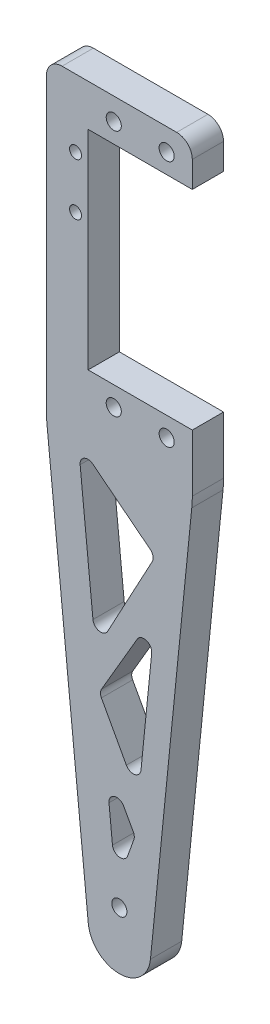
from build123d import *

# Parameters (mm, degrees)
BOSS_EXTRU_1_DEPTH      = 6
CONG_1_R                = 3
CONG_2_R                = 20
ENL_V_MAT_EXTRU_1_REACH = 118.402
ESQUISSE2_R             = 1.45
ENL_V_MAT_EXTRU_2_REACH = 118.402
CONG_3_R                = 1.5
ESQUISSE4_R             = 1.45
ENL_V_MAT_EXTRU_3_DEPTH = 6
ESQUISSE5_R             = 1.15
ENL_V_MAT_EXTRU_4_DEPTH = 6


with BuildPart() as part:
    # Esquisse1 → Boss.-Extru.1 (new body)
    with BuildSketch(Plane.XY):
        with BuildLine():
            Line((-14, -30), (-5.970001079, -110))
            ThreePointArc((-5.970001079, -110), (0, -115.400761222), (5.970001079, -110))
            Line((5.970001079, -110), (14, -30))
            Line((14, -30), (14, -18))
            Line((14, -18), (-6, -18))
            Line((-6, -18), (-6, 22))
            Line((-6, 22), (14, 22))
            Line((14, 22), (14, 30))
            Line((14, 30), (-14, 30))
            Line((-14, 30), (-14, -30))
        make_face()
    extrude(amount=BOSS_EXTRU_1_DEPTH)

    # Congé1
    cong_1_edges = [part.edges().sort_by_distance(p)[0] for p in [
        (-14, 30, 3),
        (14, 30, 3),
    ]]
    fillet(cong_1_edges, radius=CONG_1_R)

    # Congé2
    cong_2_edges = [part.edges().sort_by_distance(p)[0] for p in [
        (14, -30, 3),
        (-14, -30, 3),
    ]]
    fillet(cong_2_edges, radius=CONG_2_R)

    # Esquisse2 → Enlèv. mat.-Extru.1 (cut, up to next)
    with BuildSketch(Plane.XY.offset(6), mode=Mode.PRIVATE) as enl_v_mat_extru_1_sk1:
        with Locations((9.08, -21.75)):
            Circle(ESQUISSE2_R)
    enl_v_mat_extru_1_tool1 = extrude(enl_v_mat_extru_1_sk1.sketch, amount=-ENL_V_MAT_EXTRU_1_REACH, mode=Mode.PRIVATE) & part.part
    # Esquisse2 → Enlèv. mat.-Extru.1 (cut, up to next)
    with BuildSketch(Plane.XY.offset(6), mode=Mode.PRIVATE) as enl_v_mat_extru_1_sk2:
        with Locations((-1.08, -21.75)):
            Circle(ESQUISSE2_R)
    enl_v_mat_extru_1_tool2 = extrude(enl_v_mat_extru_1_sk2.sketch, amount=-ENL_V_MAT_EXTRU_1_REACH, mode=Mode.PRIVATE) & part.part
    # Esquisse2 → Enlèv. mat.-Extru.1 (cut, up to next)
    with BuildSketch(Plane.XY.offset(6), mode=Mode.PRIVATE) as enl_v_mat_extru_1_sk3:
        with Locations((-1.08, 25.75)):
            Circle(ESQUISSE2_R)
    enl_v_mat_extru_1_tool3 = extrude(enl_v_mat_extru_1_sk3.sketch, amount=-ENL_V_MAT_EXTRU_1_REACH, mode=Mode.PRIVATE) & part.part
    # Esquisse2 → Enlèv. mat.-Extru.1 (cut, up to next)
    with BuildSketch(Plane.XY.offset(6), mode=Mode.PRIVATE) as enl_v_mat_extru_1_sk4:
        with Locations((9.08, 25.75)):
            Circle(ESQUISSE2_R)
    enl_v_mat_extru_1_tool4 = extrude(enl_v_mat_extru_1_sk4.sketch, amount=-ENL_V_MAT_EXTRU_1_REACH, mode=Mode.PRIVATE) & part.part
    add(enl_v_mat_extru_1_tool1.solids().sort_by_distance((9.08, -21.75, 6))[0], mode=Mode.SUBTRACT)
    add(enl_v_mat_extru_1_tool2.solids().sort_by_distance((-1.08, -21.75, 6))[0], mode=Mode.SUBTRACT)
    add(enl_v_mat_extru_1_tool3.solids().sort_by_distance((-1.08, 25.75, 6))[0], mode=Mode.SUBTRACT)
    add(enl_v_mat_extru_1_tool4.solids().sort_by_distance((9.08, 25.75, 6))[0], mode=Mode.SUBTRACT)

    # Esquisse3 → Enlèv. mat.-Extru.2 (cut, up to next)
    with BuildSketch(Plane.XY.offset(6), mode=Mode.PRIVATE) as enl_v_mat_extru_2_sk1:
        Polygon((-7.886583597, -31.017533633), (-4.584381628, -63.916187805), (6.894740823, -42.63737417), align=None)
    enl_v_mat_extru_2_tool1 = extrude(enl_v_mat_extru_2_sk1.sketch, amount=-ENL_V_MAT_EXTRU_2_REACH, mode=Mode.PRIVATE) & part.part
    # Esquisse3 → Enlèv. mat.-Extru.2 (cut, up to next)
    with BuildSketch(Plane.XY.offset(6), mode=Mode.PRIVATE) as enl_v_mat_extru_2_sk2:
        Polygon((6.894740823, -52.121802831), (-3.854189345, -70.511493223), (3.66385974, -84.30991259), align=None)
    enl_v_mat_extru_2_tool2 = extrude(enl_v_mat_extru_2_sk2.sketch, amount=-ENL_V_MAT_EXTRU_2_REACH, mode=Mode.PRIVATE) & part.part
    # Esquisse3 → Enlèv. mat.-Extru.2 (cut, up to next)
    with BuildSketch(Plane.XY.offset(6), mode=Mode.PRIVATE) as enl_v_mat_extru_2_sk3:
        Polygon((-2.728137467, -80.682315655), (-0.663223344, -101.254314661), (3.006387716, -91.078168987), align=None)
    enl_v_mat_extru_2_tool3 = extrude(enl_v_mat_extru_2_sk3.sketch, amount=-ENL_V_MAT_EXTRU_2_REACH, mode=Mode.PRIVATE) & part.part
    add(enl_v_mat_extru_2_tool1.solids().sort_by_distance((-1.858741, -45.857032, 6))[0], mode=Mode.SUBTRACT)
    add(enl_v_mat_extru_2_tool2.solids().sort_by_distance((2.234804, -68.98107, 6))[0], mode=Mode.SUBTRACT)
    add(enl_v_mat_extru_2_tool3.solids().sort_by_distance((-0.128324, -91.004933, 6))[0], mode=Mode.SUBTRACT)

    # Congé3
    cong_3_edges = [part.edges().sort_by_distance(p)[0] for p in [
        (6.894740823, -52.121802831, 3),
        (3.66385974, -84.30991259, 3),
        (-3.854189345, -70.511493223, 3),
        (-2.728137467, -80.682315655, 3),
        (3.006387716, -91.078168987, 3),
        (-0.663223344, -101.254314661, 3),
        (-7.886583597, -31.017533633, 3),
        (6.894740823, -42.63737417, 3),
        (-4.584381628, -63.916187805, 3),
    ]]
    fillet(cong_3_edges, radius=CONG_3_R)

    # Esquisse4 → Enlèv. mat.-Extru.3 (cut)
    with BuildSketch(Plane.XY.offset(6)):
        with Locations((0, -104.400761222)):
            Circle(ESQUISSE4_R)
    extrude(amount=-ENL_V_MAT_EXTRU_3_DEPTH, mode=Mode.SUBTRACT)

    # Esquisse5 → Enlèv. mat.-Extru.4 (cut)
    with BuildSketch(Plane.XY.offset(6)):
        with Locations((-8.41, 17)):
            Circle(ESQUISSE5_R)
        with Locations((-8.41, 7)):
            Circle(ESQUISSE5_R)
    extrude(amount=-ENL_V_MAT_EXTRU_4_DEPTH, mode=Mode.SUBTRACT)


solid = part.part
